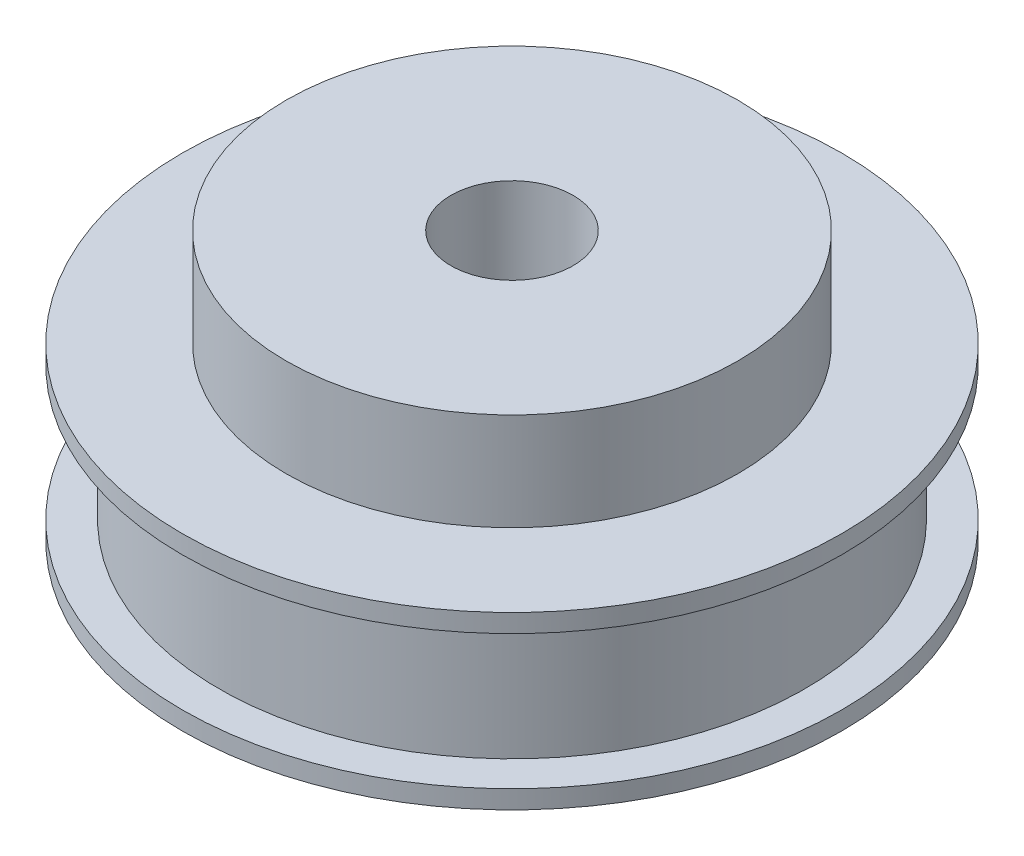
from build123d import *


with BuildPart() as part:
    # Esquisse1 → Révolution1 (revolve)
    with BuildSketch(Plane.XY, mode=Mode.PRIVATE) as r_volution1_sk:
        Polygon((5, 0), (27, 0), (27, 1.5), (24, 1.5), (24, 12.5), (27, 12.5), (27, 14), (18.5, 14), (18.5, 22), (5, 22), align=None)
    revolve(r_volution1_sk.sketch.rotate(Axis((0, 0, 0), (0, 1, 0)), 90), axis=Axis((0, 0, 0), (0, 1, 0)))


solid = part.part
